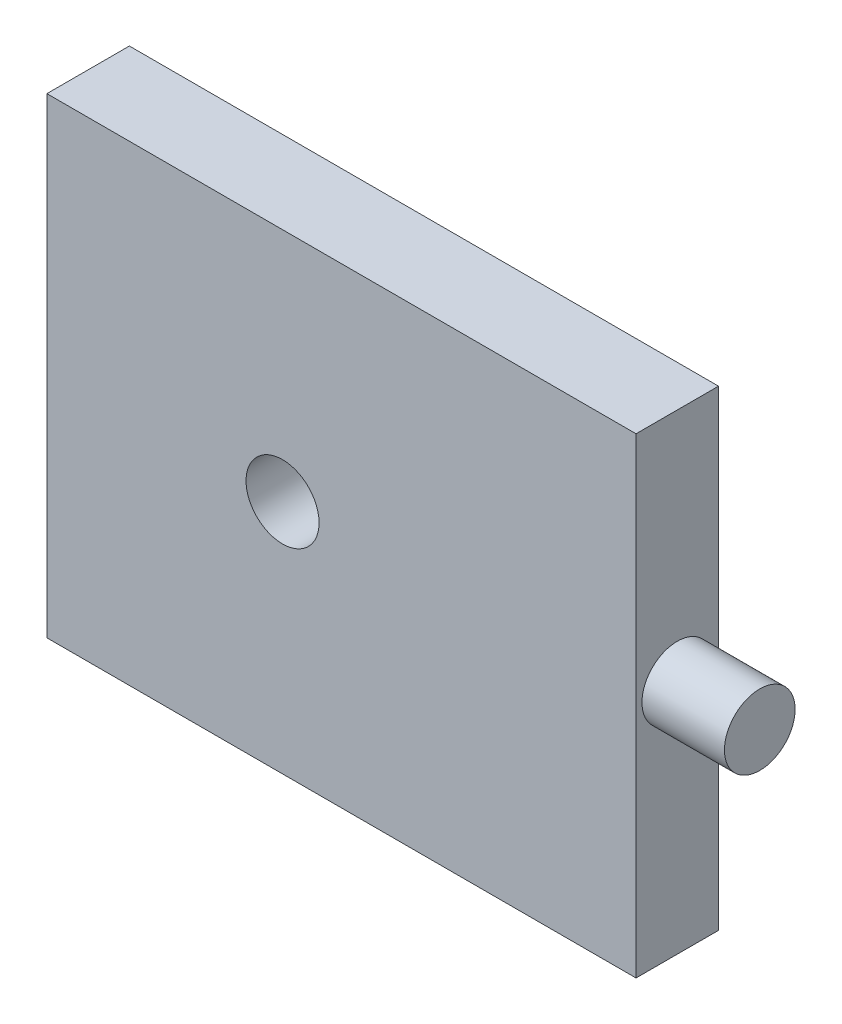
from build123d import *

# Parameters (mm, degrees)
SKETCH_1_W      = 25
SKETCH_1_H      = 20
SKETCH_1_R      = 1.55
EXTRUDE_1_DEPTH = 3.5
SKETCH_2_R      = 1.5
EXTRUDE_2_DEPTH = 3.5


with BuildPart() as part:
    # 草图1 → 凸台-拉伸1 (new body)
    with BuildSketch(Plane.XY):
        Rectangle(SKETCH_1_W, SKETCH_1_H)
        with Locations((-2.5, 0)):
            Circle(SKETCH_1_R, mode=Mode.SUBTRACT)
    extrude(amount=EXTRUDE_1_DEPTH)

    # 草图2 → 凸台-拉伸2 (add)
    with BuildSketch(Plane(origin=(12.5, 0, 0), x_dir=(0, 0, -1), z_dir=(1, 0, 0))):
        with Locations((-1.75, 0)):
            Circle(SKETCH_2_R)
    extrude(amount=EXTRUDE_2_DEPTH)


solid = part.part
